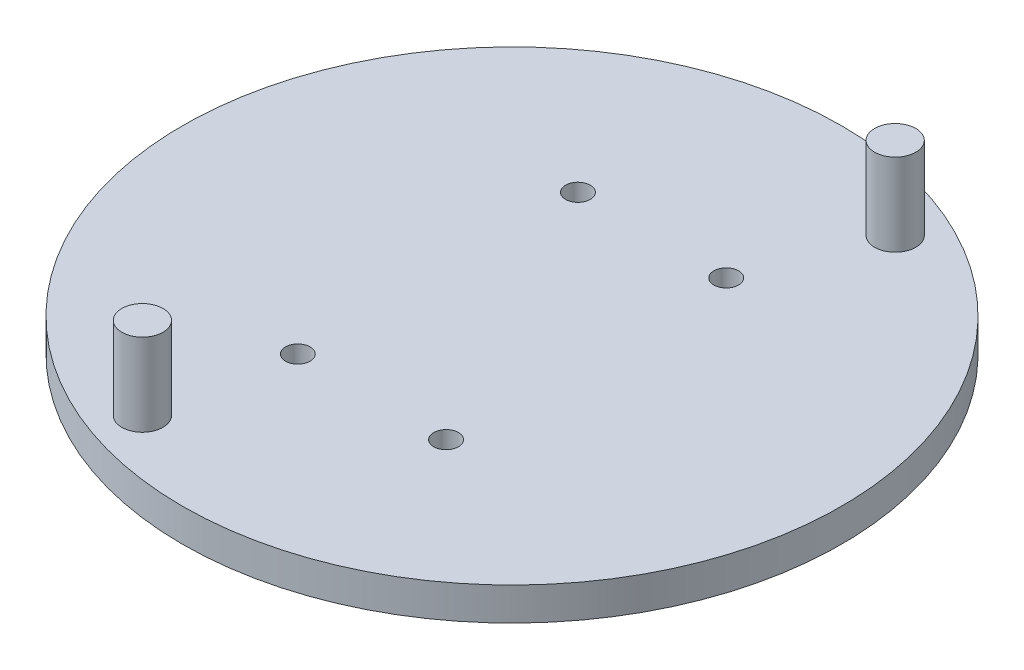
from build123d import *

# Parameters (mm, degrees)
SKETCH1_R           = 40
SKETCH1_R_2         = 1.5
BOSS_EXTRUDE1_DEPTH = 4
SKETCH2_R           = 2.5
BOSS_EXTRUDE2_DEPTH = 10


with BuildPart() as part:
    # Sketch1 → Boss-Extrude1 (new body)
    with BuildSketch(Plane(origin=(0, 0, 0), x_dir=(1, 0, 0), z_dir=(0, 1, 0))):
        with Locations(Location((0, 0, 0), (0, 0, 270))):
            Circle(SKETCH1_R)
        with Locations(Location((9, 17, 0), (0, 0, 270))):
            Circle(SKETCH1_R_2, mode=Mode.SUBTRACT)
        with Locations(Location((-9, 17, 0), (0, 0, 270))):
            Circle(SKETCH1_R_2, mode=Mode.SUBTRACT)
        with Locations(Location((-9, -17, 0), (0, 0, 270))):
            Circle(SKETCH1_R_2, mode=Mode.SUBTRACT)
        with Locations(Location((9, -17, 0), (0, 0, 270))):
            Circle(SKETCH1_R_2, mode=Mode.SUBTRACT)
    extrude(amount=BOSS_EXTRUDE1_DEPTH)

    # Sketch2 → Boss-Extrude2 (add)
    with BuildSketch(Plane(origin=(0, 4, 0), x_dir=(1, 0, 0), z_dir=(0, 1, 0))):
        with Locations(Location((14.791639161, 31.720772546, 0), (0, 0, 270))):
            Circle(SKETCH2_R)
        with Locations(Location((-11.970705016, -32.889241728, 0), (0, 0, 270))):
            Circle(SKETCH2_R)
    extrude(amount=BOSS_EXTRUDE2_DEPTH)


solid = part.part
